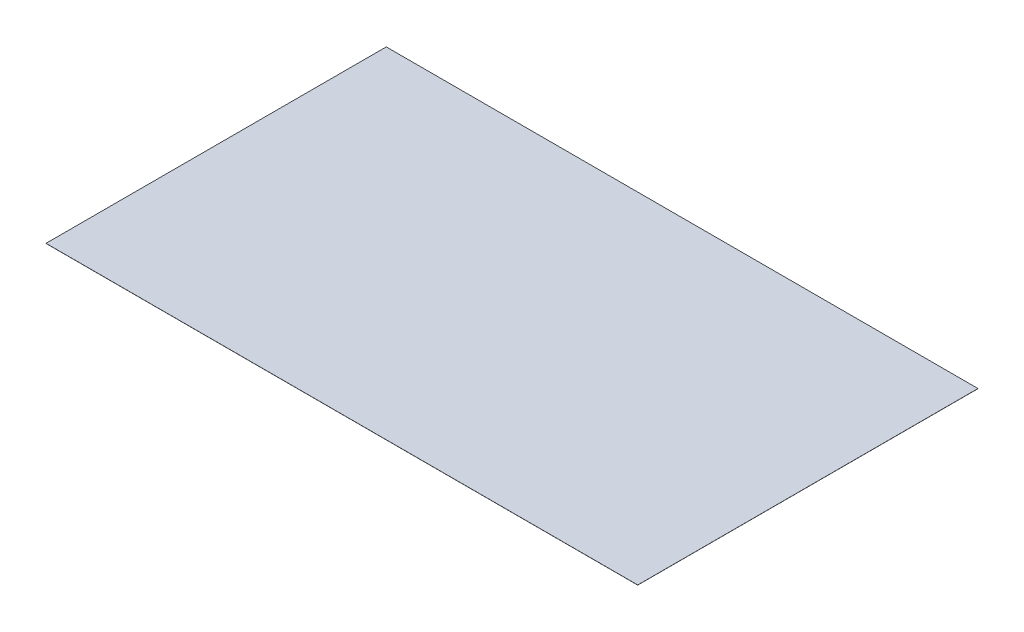
from build123d import *

# Parameters (mm, degrees)
SKETCH1_W  = 12192
SKETCH1_H  = 7010.4
BASE_DEPTH = 2.54


with BuildPart() as part:
    # Sketch1 → Base (new body)
    with BuildSketch(Plane(origin=(0, 0, 0), x_dir=(1, 0, 0), z_dir=(0, 1, 0))):
        Rectangle(SKETCH1_W, SKETCH1_H)
    extrude(amount=BASE_DEPTH)


solid = part.part
